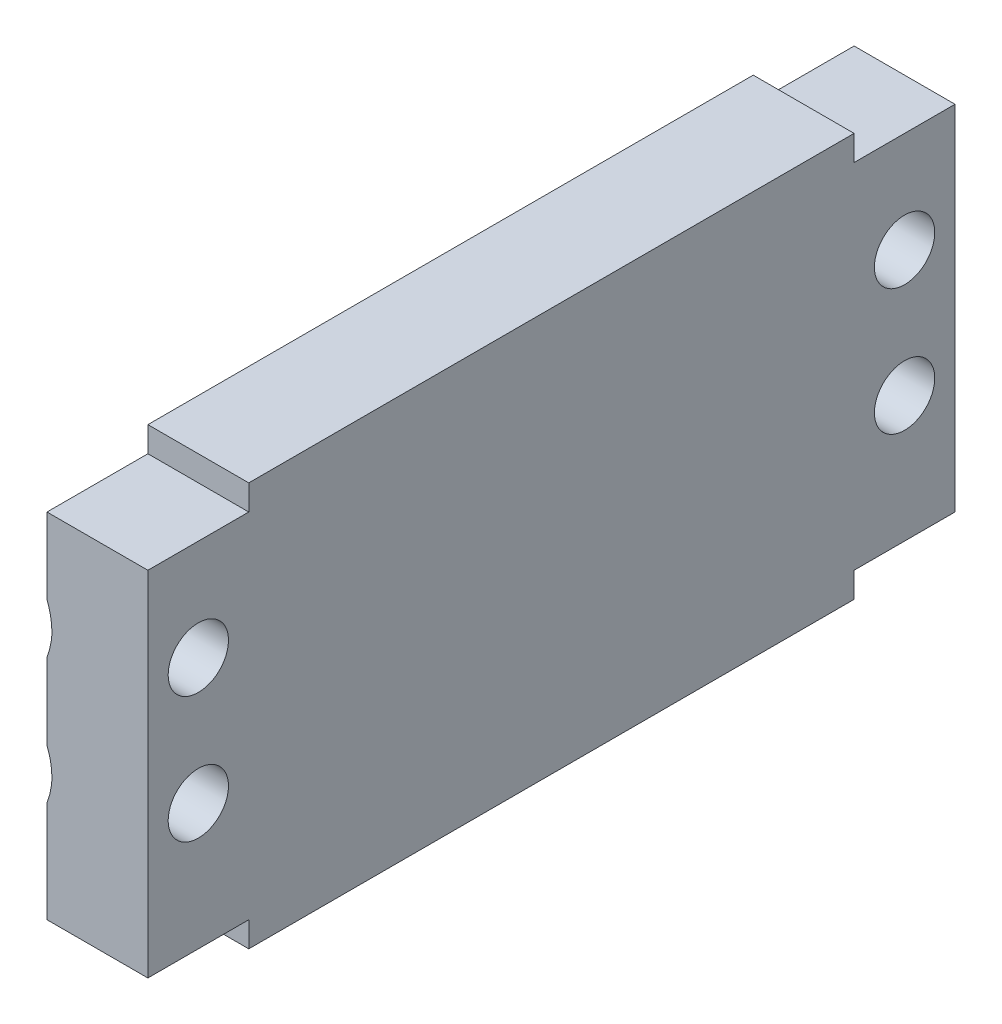
from build123d import *

# Parameters (mm, degrees)
BOSS_EXTRUDE1_DEPTH                               = 6.35
CSK_FOR_6_FLAT_HEAD_MACHINE_SCREW_100_D           = 3.7973
CSK_FOR_6_FLAT_HEAD_MACHINE_SCREW_100_CSINK_D     = 7.0866
CSK_FOR_6_FLAT_HEAD_MACHINE_SCREW_100_CSINK_ANGLE = 100


with BuildPart() as part:
    # Sketch1 → Boss-Extrude1 (new body)
    with BuildSketch(Plane(origin=(0, 0, 0), x_dir=(0, 0, -1), z_dir=(1, 0, 0))):
        Polygon((44.45, 25.4), (6.35, 25.4), (6.35, 23.8125), (0, 23.8125), (0, 1.5875), (6.35, 1.5875), (6.35, 0), (44.45, 0), (44.45, 1.5875), (50.8, 1.5875), (50.8, 23.8125), (44.45, 23.8125), align=None)
    extrude(amount=BOSS_EXTRUDE1_DEPTH)

    # CSK for #6 Flat Head Machine Screw (100)1 (through all)
    with Locations(Plane.ZY):
        with Locations((-47.625, 17.4625), (-47.625, 9.525), (-3.175, 17.4625), (-3.175, 9.525)):
            CounterSinkHole(CSK_FOR_6_FLAT_HEAD_MACHINE_SCREW_100_D / 2, CSK_FOR_6_FLAT_HEAD_MACHINE_SCREW_100_CSINK_D / 2, counter_sink_angle=CSK_FOR_6_FLAT_HEAD_MACHINE_SCREW_100_CSINK_ANGLE)


solid = part.part
